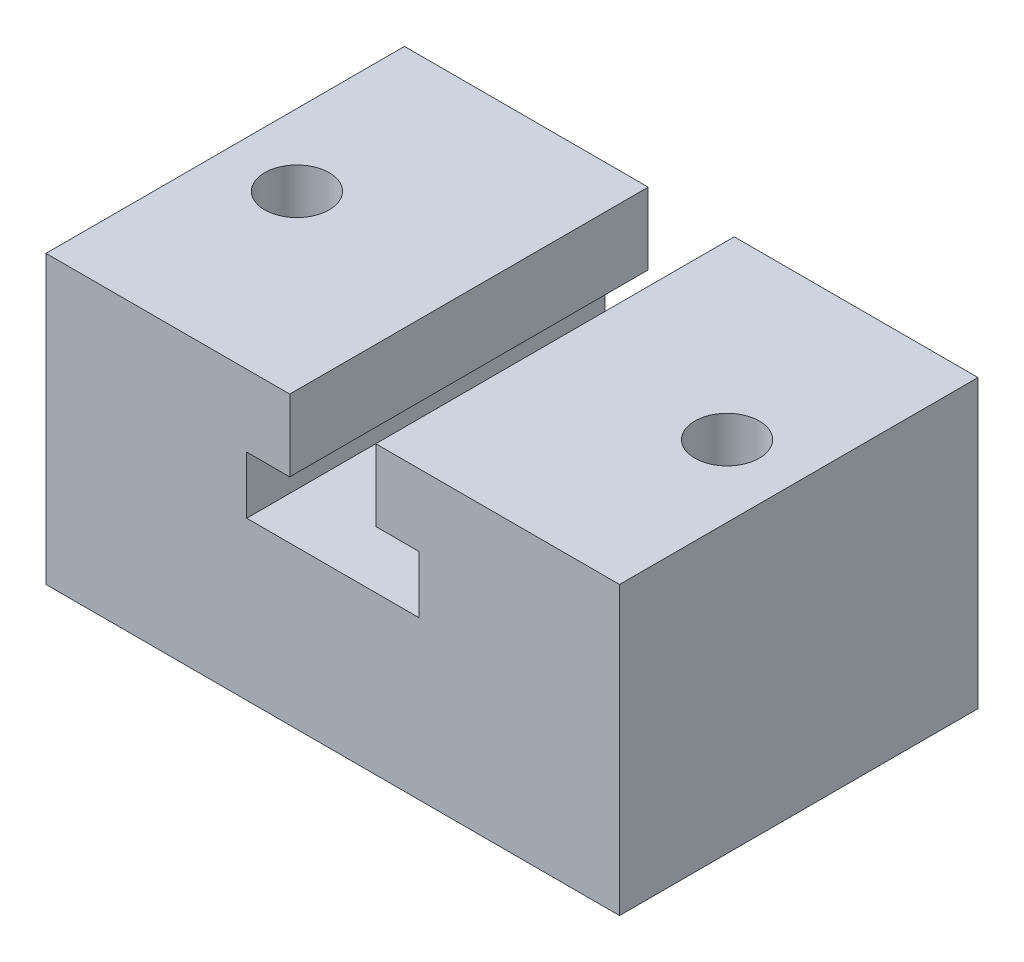
from build123d import *

# Parameters (mm, degrees)
SKETCH_1_W          = 80
SKETCH_1_H          = 40
EXTRUDE_1_DEPTH     = 50
CUT_EXTRUDE_1_DEPTH = 76.498344353
SKETCH_3_R          = 4.5
CUT_EXTRUDE_2_DEPTH = 62.846584384


with BuildPart() as part:
    # 草图1 → 凸台-拉伸1 (new body)
    with BuildSketch(Plane.XY.offset(-25)):
        with Locations((0, 20)):
            Rectangle(SKETCH_1_W, SKETCH_1_H)
    extrude(amount=EXTRUDE_1_DEPTH)

    # 草图2 → 切除-拉伸1 (cut, through all)
    with BuildSketch(Plane.XY.offset(-25)):
        Polygon((-6, 40), (6, 40), (6, 30), (12, 30), (12, 22), (-12, 22), (-12, 30), (-6, 30), align=None)
    extrude(amount=CUT_EXTRUDE_1_DEPTH, mode=Mode.SUBTRACT)

    # 草图3 → 切除-拉伸2 (cut, through all)
    with BuildSketch(Plane(origin=(0, 40, 0), x_dir=(1, 0, 0), z_dir=(0, 1, 0))):
        with Locations(Location((-30, 0, 0), (0, 0, 270))):
            Circle(SKETCH_3_R)
        with Locations(Location((30, 0, 0), (0, 0, 270))):
            Circle(SKETCH_3_R)
    extrude(amount=-CUT_EXTRUDE_2_DEPTH, mode=Mode.SUBTRACT)


solid = part.part
